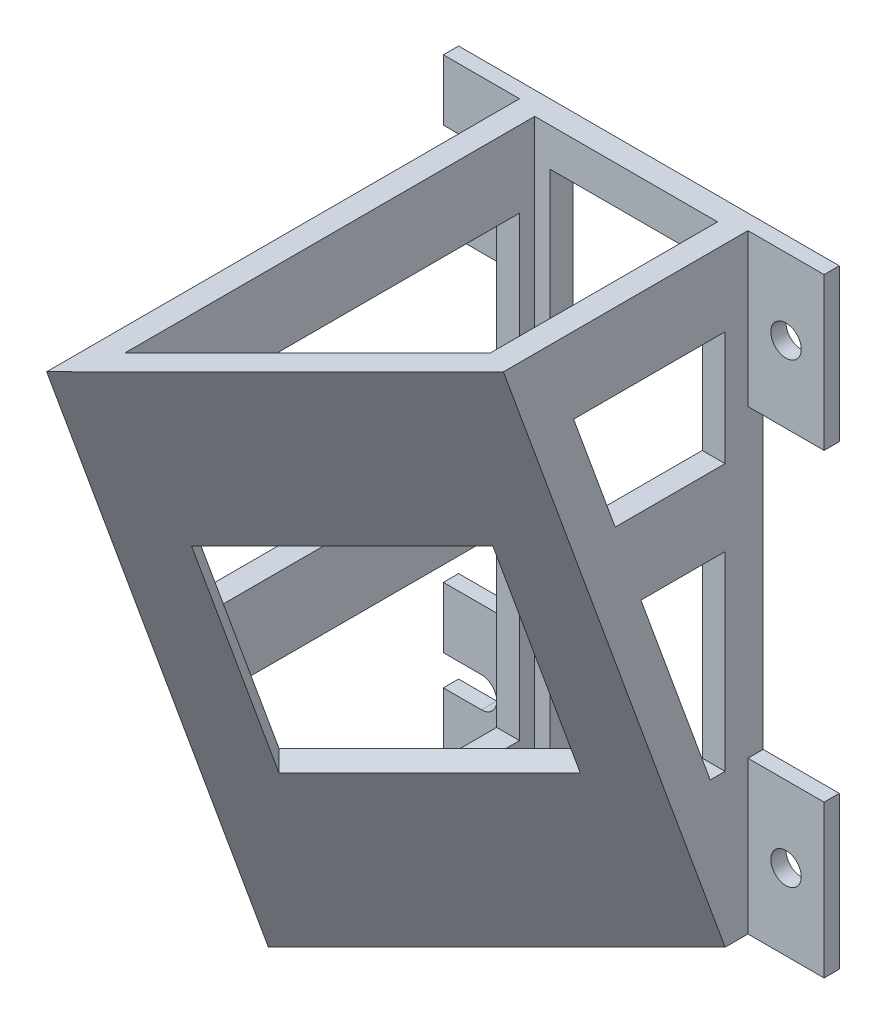
from build123d import *

# Parameters (mm, degrees)
SKETCH_1_W           = 50
SKETCH_1_H           = 80
EXTRUDE_1_DEPTH      = 80
SKETCH_4_W           = 50
SKETCH_4_H           = 160
CUT_REVOLVE_2_ANGLE  = 20
SKETCH_5_W           = 100
SKETCH_5_H           = 160
CUT_REVOLVE_4_ANGLE  = 43.2
SKETCH_6_W           = 10
SKETCH_6_H           = 80
SKETCH_6_W_2         = 10.000248079
CUT_EXTRUDE_1_DEPTH  = 80
SKETCH_7_W           = 5.91
SKETCH_7_H           = 80
CUT_EXTRUDE_2_DEPTH  = 50
SHELL_2_T            = 3
SKETCH_8_W           = 19.999751921
SKETCH_8_H           = 70
CUT_EXTRUDE_3_DEPTH  = 3
CUT_EXTRUDE_4_DEPTH  = 3
CUT_EXTRUDE_5_DEPTH  = 3
CUT_EXTRUDE_6_DEPTH  = 3
CUT_EXTRUDE_7_DEPTH  = 3
CUT_EXTRUDE_9_DEPTH  = 3
SKETCH_18_W          = 2
SKETCH_18_H          = 20
EXTRUDE_2_DEPTH      = 10
SKETCH_19_W          = 2
SKETCH_19_H          = 20
EXTRUDE_3_DEPTH      = 10
SKETCH_20_R          = 2
CUT_EXTRUDE_10_DEPTH = 2


with BuildPart() as part:
    # 草图1 → 凸台-拉伸1 (new body)
    with BuildSketch(Plane.XY):
        Rectangle(SKETCH_1_W, SKETCH_1_H)
    extrude(amount=EXTRUDE_1_DEPTH)

    # 草图4 → 切除-旋转2 (revolve, cut)
    with BuildSketch(Plane.XY.offset(80)):
        with Locations((0, -40)):
            Rectangle(SKETCH_4_W, SKETCH_4_H)
    revolve(axis=Axis((-25, 40, 80), (1, 0, 0)), revolution_arc=CUT_REVOLVE_2_ANGLE, mode=Mode.SUBTRACT)

    # 草图5 → 切除-旋转4 (revolve, cut)
    with BuildSketch(Plane(origin=(0, -21.03239325, 57.786025531), x_dir=(1, 0, 0), z_dir=(0, -0.34202014332566943, 0.9396926207859082))):
        with Locations((25, -15.050683703)):
            Rectangle(SKETCH_5_W, SKETCH_5_H)
    revolve(axis=Axis((-25, 40, 80), (0, 0.9396926207859082, 0.3420201433256695)), revolution_arc=CUT_REVOLVE_4_ANGLE, mode=Mode.SUBTRACT)

    # 草图6 → 切除-拉伸1 (cut)
    with BuildSketch(Plane(origin=(0, 0, 0), x_dir=(-1, 0, 0), z_dir=(0, 0, -1))):
        with Locations((-20, 0)):
            Rectangle(SKETCH_6_W, SKETCH_6_H)
        with Locations((19.99987596, 0)):
            Rectangle(SKETCH_6_W_2, SKETCH_6_H)
    extrude(amount=-CUT_EXTRUDE_1_DEPTH, mode=Mode.SUBTRACT)

    # 草图7 → 切除-拉伸2 (cut)
    with BuildSketch(Plane(origin=(15, 0, 0), x_dir=(0, 0, -1), z_dir=(1, 0, 0))):
        with Locations((-2.955, 0)):
            Rectangle(SKETCH_7_W, SKETCH_7_H)
    extrude(amount=-CUT_EXTRUDE_2_DEPTH, mode=Mode.SUBTRACT)

    # 抽壳2 (no face opened: a closed hollow body)
    add(offset(amount=-SHELL_2_T, mode=Mode.PRIVATE), mode=Mode.SUBTRACT)

    # 草图8 → 切除-拉伸3 (cut)
    with BuildSketch(Plane(origin=(0, 0, 5.91), x_dir=(-1, 0, 0), z_dir=(0, 0, -1))):
        with Locations((-0.000124039, 0)):
            Rectangle(SKETCH_8_W, SKETCH_8_H)
    extrude(amount=-CUT_EXTRUDE_3_DEPTH, mode=Mode.SUBTRACT)

    # 草图9 → 切除-拉伸4 (cut)
    with BuildSketch(Plane(origin=(0, 40, 0), x_dir=(1, 0, 0), z_dir=(0, 1, 0))):
        Polygon((12, -8.91), (-11.999751921, -8.91), (-11.999751921, -62.767250828), (12, -38.783592046), align=None)
    extrude(amount=-CUT_EXTRUDE_4_DEPTH, mode=Mode.SUBTRACT)

    # 草图10 → 切除-拉伸5 (cut)
    with BuildSketch(Plane.XZ.offset(40)):
        Polygon((12.756480566, 8.91), (-11.999751921, 8.91), (-11.999751921, 33.649632087), align=None)
    extrude(amount=-CUT_EXTRUDE_5_DEPTH, mode=Mode.SUBTRACT)

    # 草图11 → 切除-拉伸6 (cut)
    with BuildSketch(Plane.ZY.offset(14.999751921)):
        Polygon((10.91, -30), (10.91, -5), (48.306908226, -5), (39.207652369, -30), align=None)
        Polygon((10.91, 5), (10.91, 30), (61.045866425, 30), (51.946610569, 5), align=None)
    extrude(amount=-CUT_EXTRUDE_6_DEPTH, mode=Mode.SUBTRACT)

    # 草图15 → 切除-拉伸7 (cut)
    with BuildSketch(Plane(origin=(15, 0, 0), x_dir=(0, 0, -1), z_dir=(1, 0, 0))):
        Polygon((-30.80754043, 30), (-10.91, 30), (-10.91, 15), (-25.347986916, 15), align=None)
        Polygon((-10.91, 5), (-10.91, -20), (-12.867719255, -20), (-21.966975112, 5), align=None)
    extrude(amount=-CUT_EXTRUDE_7_DEPTH, mode=Mode.SUBTRACT)

    # 草图17 → 切除-拉伸9 (cut)
    with BuildSketch(Plane(origin=(18.971510682, -6.909698516, 18.984240647), x_dir=(0.7289686274214102, 0.23412889928290287, -0.6432638640215396), z_dir=(0.6845471059286902, -0.24932195443058733, 0.6850064399723311))):
        Polygon((-39.60181704, 0.417311671), (-12.448122913, -6.348160757), (-12.448122913, 27.257474323), (-39.60181704, 34.022946751), align=None)
    extrude(amount=-CUT_EXTRUDE_9_DEPTH, mode=Mode.SUBTRACT)

    # 草图18 → 凸台-拉伸2 (add)
    with BuildSketch(Plane(origin=(15, 0, 0), x_dir=(0, 0, -1), z_dir=(1, 0, 0))):
        with Locations((-6.91, -30)):
            Rectangle(SKETCH_18_W, SKETCH_18_H)
        with Locations((-6.91, 30)):
            Rectangle(SKETCH_18_W, SKETCH_18_H)
    extrude(amount=EXTRUDE_2_DEPTH)

    # 草图19 → 凸台-拉伸3 (add)
    with BuildSketch(Plane.ZY.offset(14.999751921)):
        with Locations((6.91, 30)):
            Rectangle(SKETCH_19_W, SKETCH_19_H)
        with Locations((6.91, -30)):
            Rectangle(SKETCH_19_W, SKETCH_19_H)
    extrude(amount=EXTRUDE_3_DEPTH)

    # 草图20 → 切除-拉伸10 (cut)
    with BuildSketch(Plane(origin=(0, 0, 5.91), x_dir=(-1, 0, 0), z_dir=(0, 0, -1))):
        with BuildLine():
            Line((24.999751921, 32), (19.999751921, 32))
            ThreePointArc((19.999751921, 32), (17.999751921, 30), (19.999751921, 28))
            Line((19.999751921, 28), (24.999751921, 28))
            Line((24.999751921, 28), (24.999751921, 32))
        make_face()
        with BuildLine():
            Line((19.999751921, -32), (24.999751921, -32))
            Line((24.999751921, -32), (24.999751921, -28))
            Line((24.999751921, -28), (19.999751921, -28))
            ThreePointArc((19.999751921, -28), (17.999751921, -30), (19.999751921, -32))
        make_face()
        with Locations(Location((-20, 30, 0), (0, 0, 90))):
            Circle(SKETCH_20_R)
        with Locations(Location((-20, -30, 0), (0, 0, 90))):
            Circle(SKETCH_20_R)
    extrude(amount=-CUT_EXTRUDE_10_DEPTH, mode=Mode.SUBTRACT)


solid = part.part
